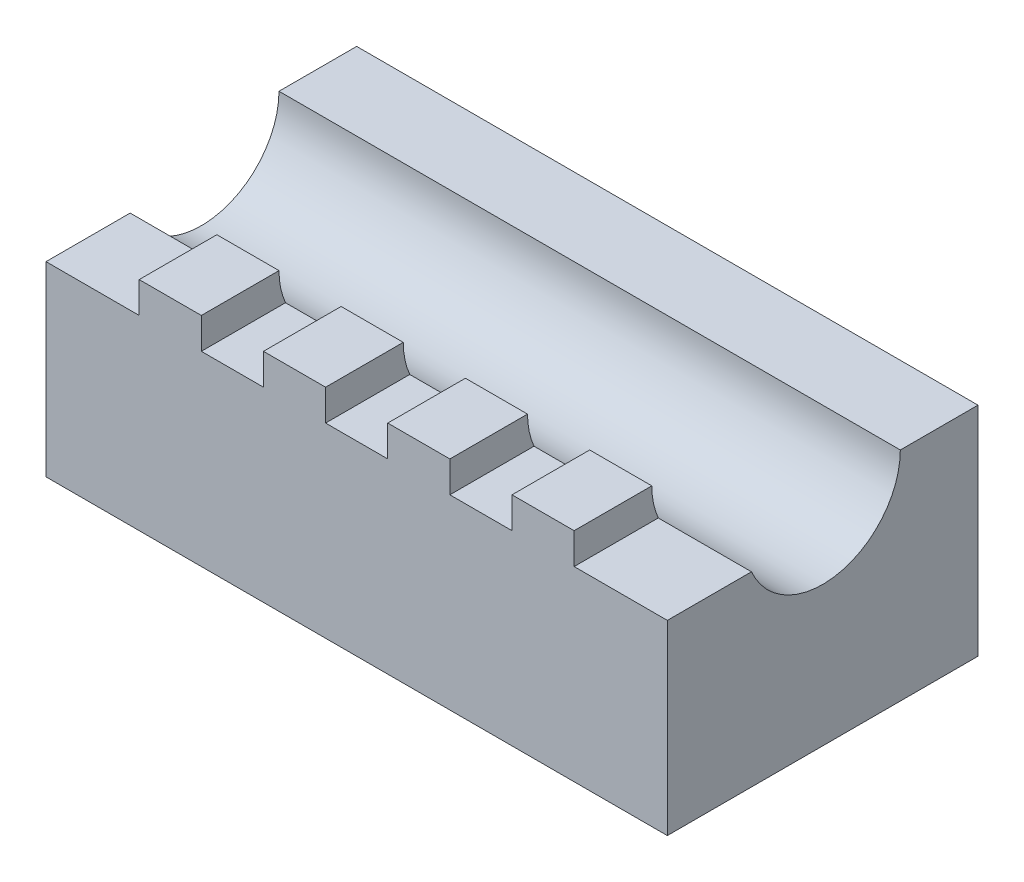
from build123d import *

# Parameters (mm, degrees)
SKETCH1_W           = 100
SKETCH1_H           = 35
BOSS_EXTRUDE1_DEPTH = 50
SKETCH4_R           = 12.5
CUT_EXTRUDE2_DEPTH  = 100
SKETCH5_W           = 15
SKETCH5_H           = 5
SKETCH5_W_2         = 10
CUT_EXTRUDE3_DEPTH  = 25


with BuildPart() as part:
    # Sketch1 → Boss-Extrude1 (new body)
    with BuildSketch(Plane.XY):
        with Locations((50, 17.5)):
            Rectangle(SKETCH1_W, SKETCH1_H)
    extrude(amount=BOSS_EXTRUDE1_DEPTH)

    # Sketch4 → Cut-Extrude2 (cut)
    with BuildSketch(Plane(origin=(100, 0, 0), x_dir=(0, 0, -1), z_dir=(1, 0, 0))):
        with Locations((-25, 35)):
            Circle(SKETCH4_R)
    extrude(amount=-CUT_EXTRUDE2_DEPTH, mode=Mode.SUBTRACT)

    # Sketch5 → Cut-Extrude3 (cut)
    with BuildSketch(Plane.XY.offset(50)):
        with Locations((7.5, 32.5)):
            Rectangle(SKETCH5_W, SKETCH5_H)
        with Locations((30, 32.5)):
            Rectangle(SKETCH5_W_2, SKETCH5_H)
        with Locations((70, 32.5)):
            Rectangle(SKETCH5_W_2, SKETCH5_H)
        with Locations((92.5, 32.5)):
            Rectangle(SKETCH5_W, SKETCH5_H)
        with Locations((50, 32.5)):
            Rectangle(SKETCH5_W_2, SKETCH5_H)
    extrude(amount=-CUT_EXTRUDE3_DEPTH, mode=Mode.SUBTRACT)


solid = part.part
